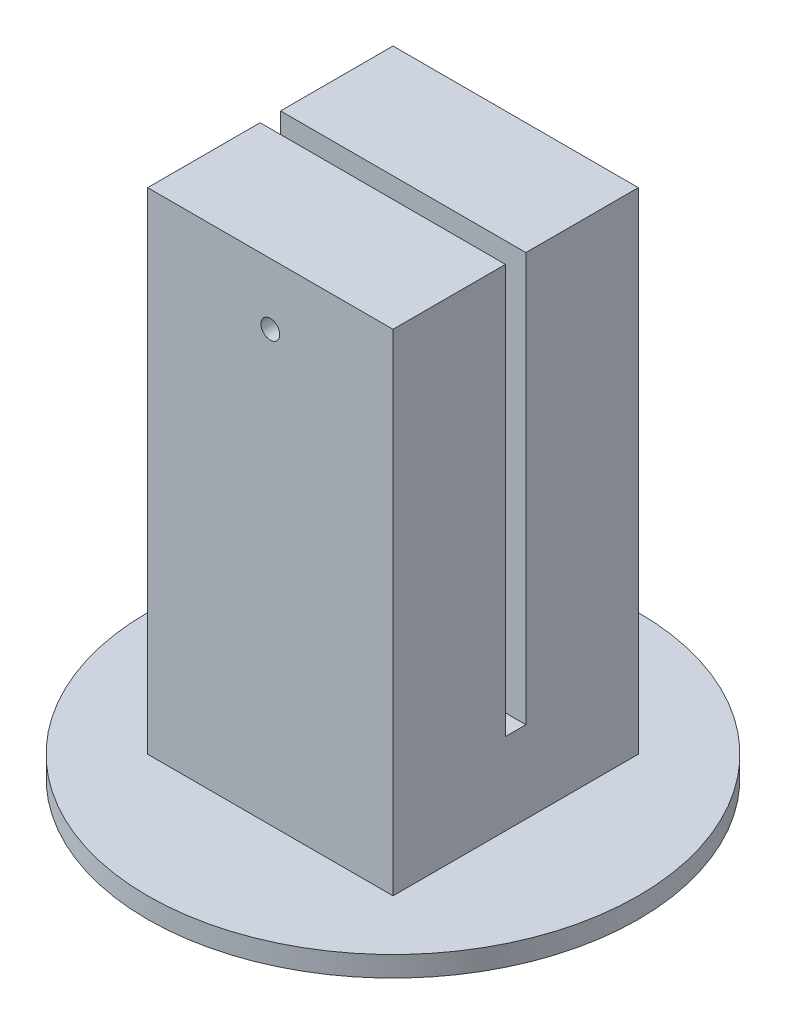
from build123d import *

# Parameters (mm, degrees)
SKETCH1_R           = 38.1
BOSS_EXTRUDE1_DEPTH = 3.175
SKETCH2_W           = 38.1
SKETCH2_H           = 38.1
BOSS_EXTRUDE3_DEPTH = 76.2
CUT_EXTRUDE1_DEPTH  = 105.967247868
SKETCH6_R           = 1.4605
CUT_EXTRUDE2_DEPTH  = 105.967247868


with BuildPart() as part:
    # Sketch1 → Boss-Extrude1 (new body)
    with BuildSketch(Plane(origin=(0, 0, 0), x_dir=(1, 0, 0), z_dir=(0, 1, 0))):
        with Locations(Location((0, 0, 0), (0, 0, 270))):
            Circle(SKETCH1_R)
    extrude(amount=BOSS_EXTRUDE1_DEPTH)

    # Sketch2 → Boss-Extrude3 (add)
    with BuildSketch(Plane(origin=(0, 3.175, 0), x_dir=(1, 0, 0), z_dir=(0, 1, 0))):
        Rectangle(SKETCH2_W, SKETCH2_H)
    extrude(amount=BOSS_EXTRUDE3_DEPTH)

    # Sketch5 → Cut-Extrude1 (cut, through all)
    with BuildSketch(Plane.ZY.offset(19.05)):
        Polygon((0, 79.375), (-1.5875, 79.375), (-1.5875, 15.875), (1.5875, 15.875), (1.5875, 79.375), align=None)
    extrude(amount=-CUT_EXTRUDE1_DEPTH, mode=Mode.SUBTRACT)

    # Sketch6 → Cut-Extrude2 (cut, through all)
    with BuildSketch(Plane.XY.offset(19.05)):
        with Locations((0, 69.85)):
            Circle(SKETCH6_R)
    extrude(amount=-CUT_EXTRUDE2_DEPTH, mode=Mode.SUBTRACT)


solid = part.part
